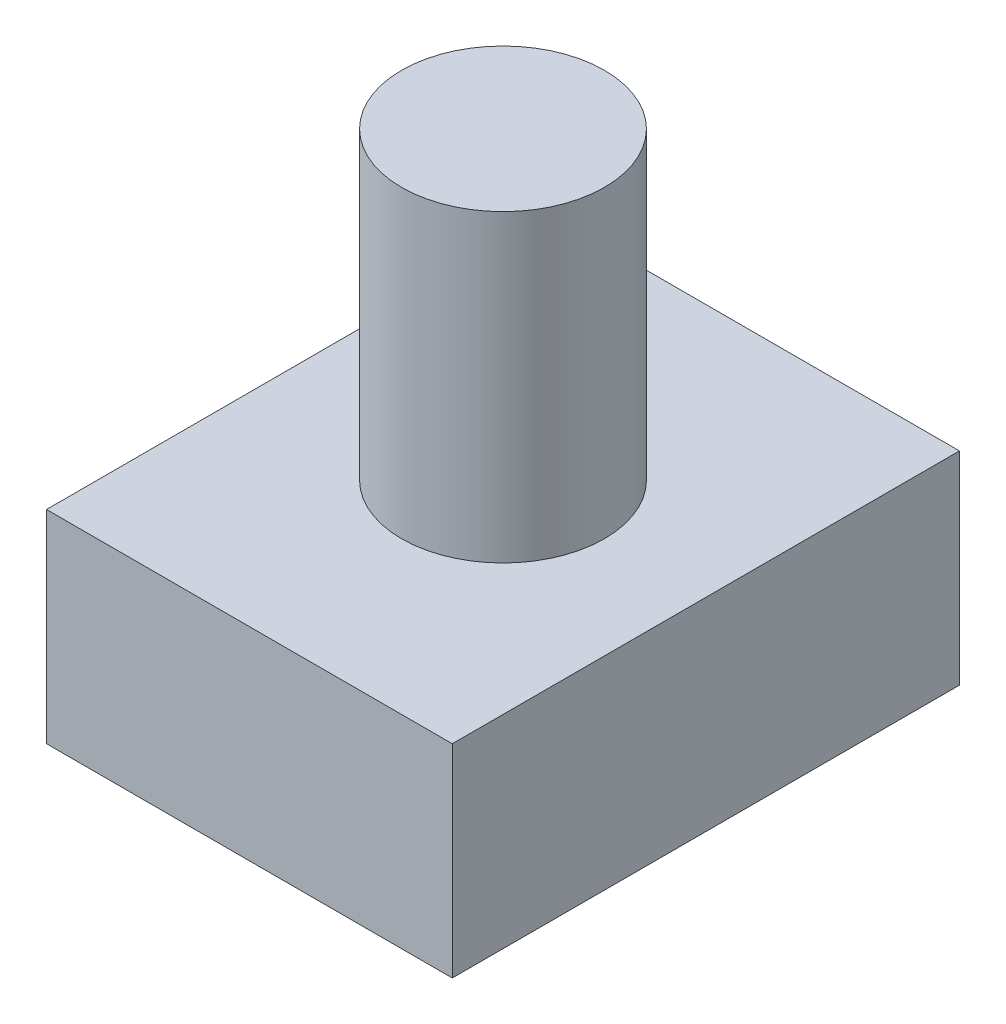
from build123d import *

# Parameters (mm, degrees)
SKETCH1_W           = 40
SKETCH1_H           = 50
BOSS_EXTRUDE1_DEPTH = 20
SKETCH2_R           = 10
BOSS_EXTRUDE2_DEPTH = 30


with BuildPart() as part:
    # Sketch1 → Boss-Extrude1 (new body)
    with BuildSketch(Plane(origin=(0, 0, 0), x_dir=(1, 0, 0), z_dir=(0, 1, 0))):
        with Locations((20, 25)):
            Rectangle(SKETCH1_W, SKETCH1_H)
    extrude(amount=BOSS_EXTRUDE1_DEPTH)

    # Sketch2 → Boss-Extrude2 (add)
    with BuildSketch(Plane(origin=(0, 20, 0), x_dir=(1, 0, 0), z_dir=(0, 1, 0))):
        with Locations(Location((20, 25, 0), (0, 0, 270))):
            Circle(SKETCH2_R)
    extrude(amount=BOSS_EXTRUDE2_DEPTH)


solid = part.part
